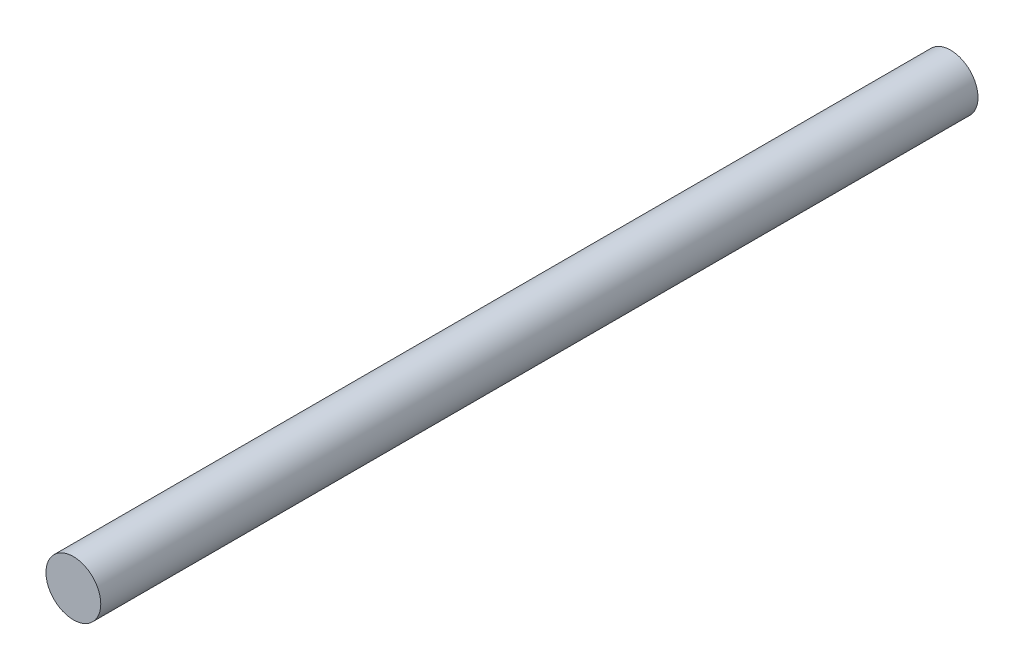
from build123d import *

# Parameters (mm, degrees)
SKETCH1_R          = 1.5875
BASE_EXTRUDE_DEPTH = 25.4


with BuildPart() as part:
    # Sketch1 → Base Extrude (new, symmetric)
    with BuildSketch(Plane.XY):
        Circle(SKETCH1_R)
    extrude(amount=BASE_EXTRUDE_DEPTH, both=True)


solid = part.part
